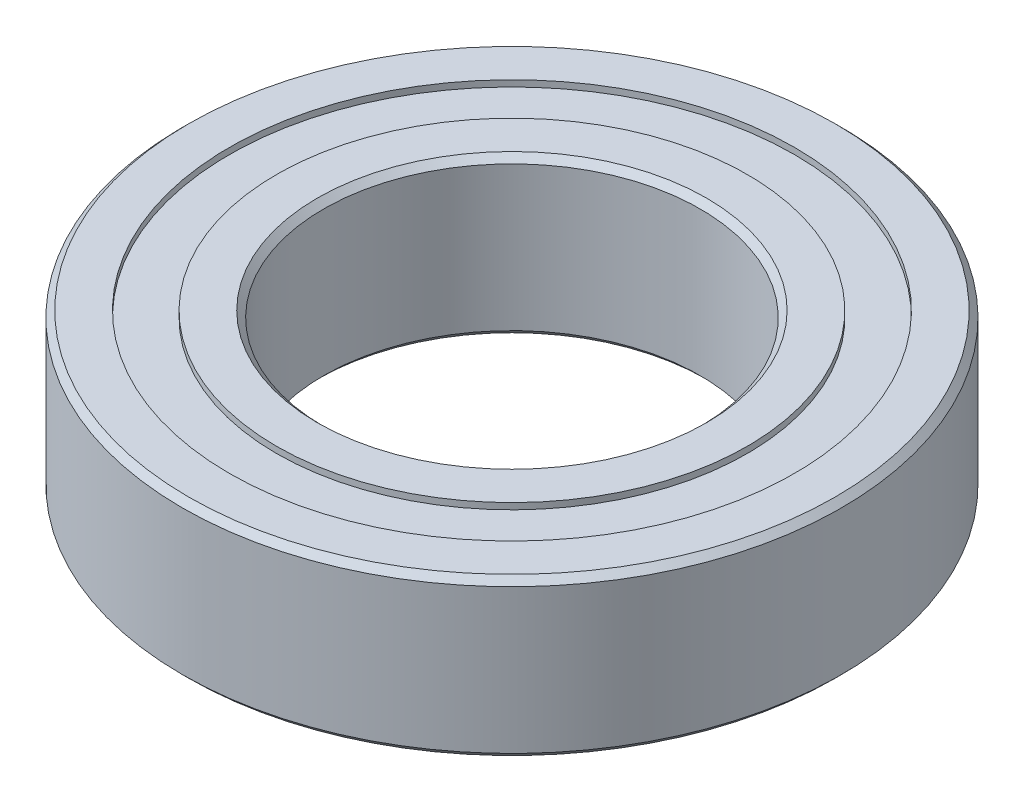
from build123d import *

# Parameters (mm, degrees)
SKETCH1_R           = 10.5
SKETCH1_R_2         = 6
BOSS_EXTRUDE1_DEPTH = 5
SKETCH2_R           = 9
SKETCH2_R_2         = 7.5
CUT_EXTRUDE1_DEPTH  = 0.2
CUT_EXTRUDE2_START  = -0.2
SKETCH3_R           = 9
SKETCH3_R_2         = 7.5
CUT_EXTRUDE2_DEPTH  = 0.2
CHAMFER1_SIZE       = 0.2


with BuildPart() as part:
    # Sketch1 → Boss-Extrude1 (new body)
    with BuildSketch(Plane(origin=(0, 0, 0), x_dir=(1, 0, 0), z_dir=(0, 1, 0))):
        with Locations(Location((0, 0, 0), (0, 0, 270))):
            Circle(SKETCH1_R)
        with Locations(Location((0, 0, 0), (0, 0, 270))):
            Circle(SKETCH1_R_2, mode=Mode.SUBTRACT)
    extrude(amount=BOSS_EXTRUDE1_DEPTH)

    # Sketch2 → Cut-Extrude1 (cut)
    with BuildSketch(Plane(origin=(0, 5, 0), x_dir=(1, 0, 0), z_dir=(0, 1, 0))):
        with Locations(Location((0, 0, 0), (0, 0, 270))):
            Circle(SKETCH2_R)
        with Locations(Location((0, 0, 0), (0, 0, 270))):
            Circle(SKETCH2_R_2, mode=Mode.SUBTRACT)
    extrude(amount=-CUT_EXTRUDE1_DEPTH, mode=Mode.SUBTRACT)

    # Sketch3 → Cut-Extrude2 (cut)
    with BuildSketch(Plane.XZ.offset(CUT_EXTRUDE2_START)):
        with Locations(Location((0, 0, 0), (0, 0, 90))):
            Circle(SKETCH3_R)
        with Locations(Location((0, 0, 0), (0, 0, 90))):
            Circle(SKETCH3_R_2, mode=Mode.SUBTRACT)
    extrude(amount=CUT_EXTRUDE2_DEPTH, mode=Mode.SUBTRACT)

    # Chamfer1
    chamfer1_edges = [part.edges().sort_by_distance(p)[0] for p in [
        (0, 0, -10.5),
        (0, 5, -10.5),
        (0, 0, -6),
        (0, 5, -6),
    ]]
    chamfer(chamfer1_edges, length=CHAMFER1_SIZE)


solid = part.part
